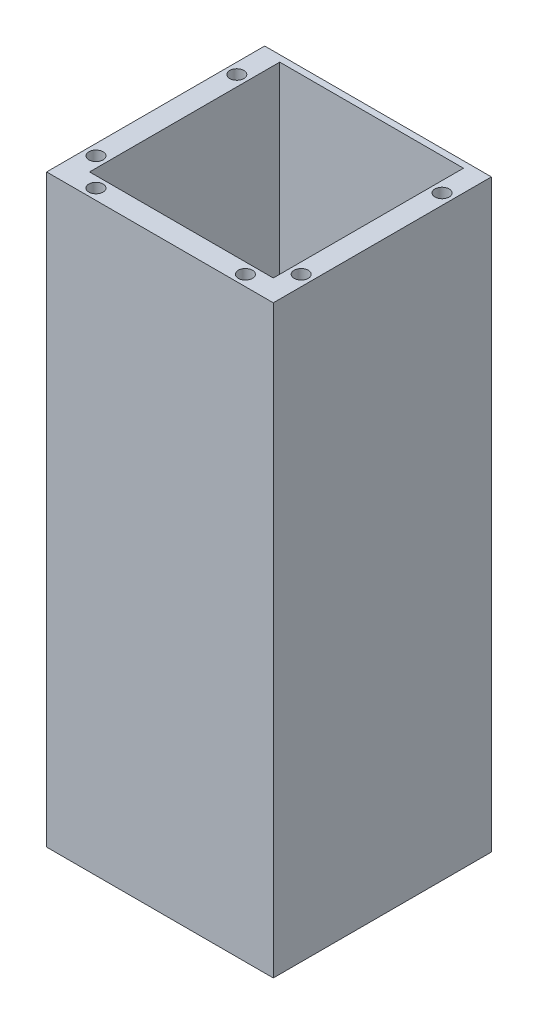
from build123d import *

# Parameters (mm, degrees)
ESQUISSE1_W             = 105.6
ESQUISSE1_H             = 272.4
BOSS_EXTRU_1_DEPTH      = 101.6
ESQUISSE3_W             = 85.6
ESQUISSE3_H             = 88.6
ENL_V_MAT_EXTRU_1_DEPTH = 262.4
ESQUISSE4_W             = 85.6
ESQUISSE4_H             = 20
ENL_V_MAT_EXTRU_2_DEPTH = 30
ESQUISSE5_W             = 85.6
ESQUISSE5_H             = 65.6
ENL_V_MAT_EXTRU_3_DEPTH = 30
D_GAGEMENT_M61_D        = 6.6
D_GAGEMENT_M61_DEPTH    = 10
D_GAGEMENT_M61_TIP      = 1.982840043


with BuildPart() as part:
    # Esquisse1 → Boss.-Extru.1 (new body)
    with BuildSketch(Plane.XY):
        with Locations((-5.189173744, -81.220813953)):
            Rectangle(ESQUISSE1_W, ESQUISSE1_H)
    extrude(amount=BOSS_EXTRU_1_DEPTH)

    # Esquisse3 → Enlèv. mat.-Extru.1 (cut)
    with BuildSketch(Plane(origin=(0, 54.979186047, 0), x_dir=(1, 0, 0), z_dir=(0, 1, 0))):
        with Locations((-5.189173744, -47.3)):
            Rectangle(ESQUISSE3_W, ESQUISSE3_H)
    extrude(amount=-ENL_V_MAT_EXTRU_1_DEPTH, mode=Mode.SUBTRACT)

    # Esquisse4 → Enlèv. mat.-Extru.2 (cut)
    with BuildSketch(Plane.XZ.offset(217.420813953)):
        with Locations((-5.189173744, 81.6)):
            Rectangle(ESQUISSE4_W, ESQUISSE4_H)
    extrude(amount=-ENL_V_MAT_EXTRU_2_DEPTH, mode=Mode.SUBTRACT)

    # Esquisse5 → Enlèv. mat.-Extru.3 (cut)
    with BuildSketch(Plane(origin=(0, 0, 0), x_dir=(-1, 0, 0), z_dir=(0, 0, -1))):
        with Locations((5.189173744, -174.620813953)):
            Rectangle(ESQUISSE5_W, ESQUISSE5_H)
    extrude(amount=-ENL_V_MAT_EXTRU_3_DEPTH, mode=Mode.SUBTRACT)

    # Dégagement M61
    with Locations(Plane(origin=(-52.989173744, 54.979186047, 18), x_dir=(0, 0, 1), z_dir=(0, 1, 0))):
        with Locations((0, 0), (65.6, 0), (0, 95.6), (65.6, 95.6), (78.6, 13), (78.6, 82.6)):
            Hole(D_GAGEMENT_M61_D / 2, depth=D_GAGEMENT_M61_DEPTH)
            with Locations((0, 0, -(D_GAGEMENT_M61_DEPTH + D_GAGEMENT_M61_TIP / 2))):  # 118° drill point
                Cone(0, D_GAGEMENT_M61_D / 2, D_GAGEMENT_M61_TIP, mode=Mode.SUBTRACT)


solid = part.part
